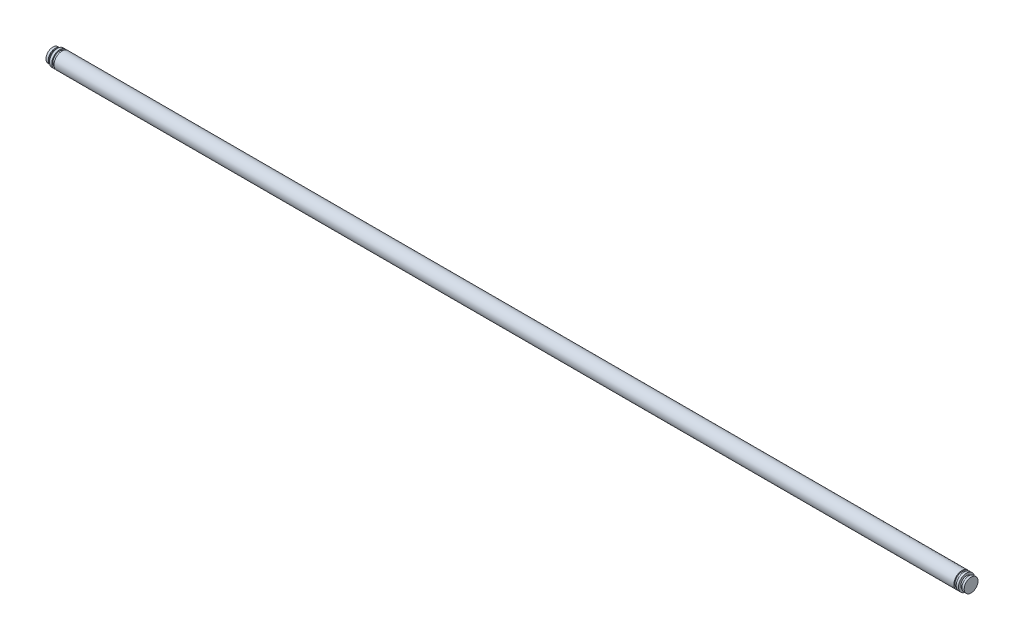
from build123d import *

# Parameters (mm, degrees)
SKETCH1_R            = 3.5
BOSS_EXTRUDE1_DEPTH  = 196
SKETCH6_R            = 2.999428485
BOSS_EXTRUDE4_DEPTH  = 1
BOSS_EXTRUDE5_START  = 1
SKETCH7_R            = 3.5
BOSS_EXTRUDE5_DEPTH  = 1
SKETCH8_R            = 2.50271342
BOSS_EXTRUDE6_DEPTH  = 1
SKETCH9_R            = 3.004216162
BOSS_EXTRUDE7_DEPTH  = 1
SKETCH10_R           = 2.999964983
BOSS_EXTRUDE8_DEPTH  = 1
SKETCH11_R           = 3.5
BOSS_EXTRUDE9_DEPTH  = 1
SKETCH12_R           = 2.504776308
BOSS_EXTRUDE10_DEPTH = 1
SKETCH13_R           = 3.002711456
BOSS_EXTRUDE11_DEPTH = 1


with BuildPart() as part:
    # Sketch1 → Boss-Extrude1 (new, symmetric)
    with BuildSketch(Plane(origin=(0, 0, 0), x_dir=(0, 0, -1), z_dir=(1, 0, 0))):
        Circle(SKETCH1_R)
    extrude(amount=BOSS_EXTRUDE1_DEPTH, both=True)

    # Sketch6 → Boss-Extrude4 (add)
    with BuildSketch(Plane(origin=(196, 0, 0), x_dir=(0, 0, -1), z_dir=(1, 0, 0))):
        Circle(SKETCH6_R)
    extrude(amount=BOSS_EXTRUDE4_DEPTH)

    # Sketch7 → Boss-Extrude5 (add)
    with BuildSketch(Plane(origin=(197, 0, 0), x_dir=(0, 0, -1), z_dir=(1, 0, 0)).offset(BOSS_EXTRUDE5_START)):
        Circle(SKETCH7_R)
    extrude(amount=-BOSS_EXTRUDE5_DEPTH)

    # Sketch8 → Boss-Extrude6 (add)
    with BuildSketch(Plane(origin=(198, 0, 0), x_dir=(0, 0, -1), z_dir=(1, 0, 0))):
        Circle(SKETCH8_R)
    extrude(amount=BOSS_EXTRUDE6_DEPTH)

    # Sketch9 → Boss-Extrude7 (add)
    with BuildSketch(Plane(origin=(199, 0, 0), x_dir=(0, 0, -1), z_dir=(1, 0, 0))):
        Circle(SKETCH9_R)
    extrude(amount=BOSS_EXTRUDE7_DEPTH)

    # Sketch10 → Boss-Extrude8 (add)
    with BuildSketch(Plane.ZY.offset(196)):
        Circle(SKETCH10_R)
    extrude(amount=BOSS_EXTRUDE8_DEPTH)

    # Sketch11 → Boss-Extrude9 (add)
    with BuildSketch(Plane.ZY.offset(197)):
        with Locations(Location((0, 0, 0), (0, 0, 180))):
            Circle(SKETCH11_R)
    extrude(amount=BOSS_EXTRUDE9_DEPTH)

    # Sketch12 → Boss-Extrude10 (add)
    with BuildSketch(Plane.ZY.offset(198)):
        Circle(SKETCH12_R)
    extrude(amount=BOSS_EXTRUDE10_DEPTH)

    # Sketch13 → Boss-Extrude11 (add)
    with BuildSketch(Plane.ZY.offset(199)):
        Circle(SKETCH13_R)
    extrude(amount=BOSS_EXTRUDE11_DEPTH)


solid = part.part
